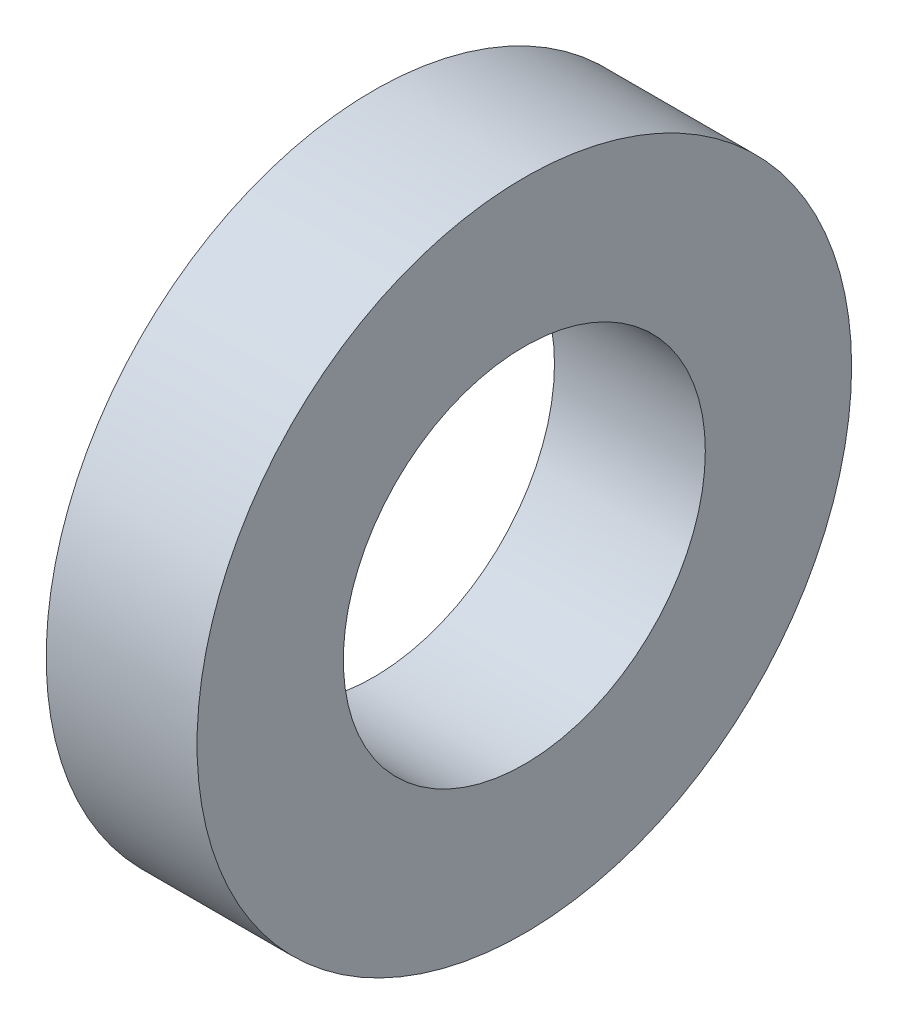
from build123d import *

# Parameters (mm, degrees)
SKETCH_1_R      = 10.849493736
SKETCH_1_R_2    = 6
EXTRUDE_1_DEPTH = 5


with BuildPart() as part:
    # 草图1 → 凸台-拉伸1 (new body)
    with BuildSketch(Plane(origin=(0, 0, 0), x_dir=(0, 0, -1), z_dir=(1, 0, 0))):
        Circle(SKETCH_1_R)
        Circle(SKETCH_1_R_2, mode=Mode.SUBTRACT)
    extrude(amount=EXTRUDE_1_DEPTH)


solid = part.part
